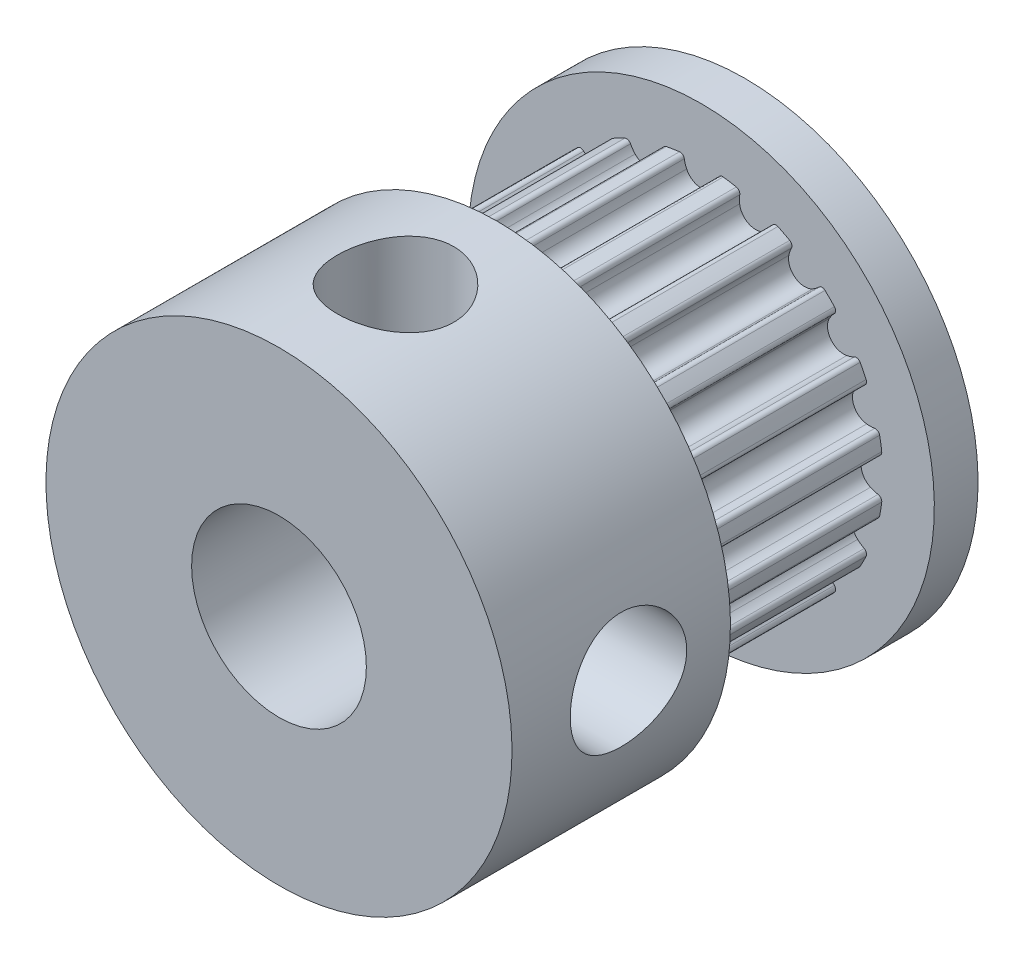
from build123d import *

# Parameters (mm, degrees)
CROQUIS1_R              = 6.366
SALIENTE_EXTRUIR1_DEPTH = 7
CORTAR_EXTRUIR1_DEPTH   = 12.404030516
MATRIZC1_COUNT          = 20
CROQUIS5_W              = 1.5
CROQUIS5_H              = 8
CROQUIS5_W_2            = 7.5
CROQUIS6_R              = 3
CORTAR_EXTRUIR2_DEPTH   = 20.595917942
CROQUIS8_R              = 2
CORTAR_EXTRUIR3_DEPTH   = 19.391574158
CROQUIS9_R              = 2
CORTAR_EXTRUIR4_DEPTH   = 19.391574324


with BuildPart() as part:
    # Croquis1 → Saliente-Extruir1 (new body)
    with BuildSketch(Plane.XY):
        Circle(CROQUIS1_R)
    extrude(amount=SALIENTE_EXTRUIR1_DEPTH)

    # Croquis3 → Cortar-Extruir1 (cut, through all)
    with BuildSketch(Plane(origin=(0, 0, 0), x_dir=(-1, 0, 0), z_dir=(0, 0, -1))):
        with BuildLine():
            Line((-7.140411071, 45.082781216), (-0.995861804, 6.287623976))
            Line((-0.995861804, 6.287623976), (-0.975994627, 6.162187557))
            ThreePointArc((-0.975994627, 6.162187557), (-0.863064611, 6.179016142), (-0.749845546, 6.193775315))
            ThreePointArc((-0.749845546, 6.193775315), (-0.641504612, 6.164627299), (-0.583688192, 6.068478318))
            ThreePointArc((-0.583688192, 6.068478318), (-0.55273127, 5.93441999), (-0.503666473, 5.805879678))
            ThreePointArc((-0.503666473, 5.805879678), (0, 5.484), (0.503666473, 5.805879678))
            ThreePointArc((0.503666473, 5.805879678), (0.55273127, 5.93441999), (0.583688192, 6.068478318))
            ThreePointArc((0.583688192, 6.068478318), (0.641504612, 6.164627299), (0.749845546, 6.193775315))
            ThreePointArc((0.749845546, 6.193775315), (0.863064611, 6.179016142), (0.975994627, 6.162187557))
            Line((0.975994627, 6.162187557), (0.995861804, 6.287623976))
            Line((0.995861804, 6.287623976), (7.140411071, 45.082781216))
            Line((7.140411071, 45.082781216), (7.140411071, 123.640268725))
            Line((7.140411071, 123.640268725), (-7.140411071, 123.640268725))
            Line((-7.140411071, 123.640268725), (-7.140411071, 45.082781216))
        make_face()
    cortar_extruir1 = extrude(amount=-CORTAR_EXTRUIR1_DEPTH, mode=Mode.SUBTRACT)

    # MatrizC1: Cortar-Extruir1 ×20 about axis
    matrizc1_axis = Axis((0, 0, 0), (0, 0, 1))
    for i in range(1, MATRIZC1_COUNT):
        add(cortar_extruir1.rotate(matrizc1_axis, i * 360 / MATRIZC1_COUNT), mode=Mode.SUBTRACT)

    # Croquis5 → Revolución1 (revolve)
    with BuildSketch(Plane(origin=(0, 0, 0), x_dir=(0, 0, -1), z_dir=(1, 0, 0))):
        with Locations((0.75, 4)):
            Rectangle(CROQUIS5_W, CROQUIS5_H)
        with Locations((-10.75, 4)):
            Rectangle(CROQUIS5_W_2, CROQUIS5_H)
    revolve(axis=Axis((0, 0, 7), (0, 0, 1)))

    # Croquis6 → Cortar-Extruir2 (cut, through all)
    with BuildSketch(Plane.XY.offset(14.5)):
        Circle(CROQUIS6_R)
    extrude(amount=-CORTAR_EXTRUIR2_DEPTH, mode=Mode.SUBTRACT)

    # Croquis8 → Cortar-Extruir3 (cut, through all)
    with BuildSketch(Plane(origin=(0, 0, 0), x_dir=(1, 0, 0), z_dir=(0, 1, 0))):
        with Locations(Location((0, -10.5, 0), (0, 0, 90))):
            Circle(CROQUIS8_R)
    extrude(amount=CORTAR_EXTRUIR3_DEPTH, mode=Mode.SUBTRACT)

    # Croquis9 → Cortar-Extruir4 (cut, through all)
    with BuildSketch(Plane(origin=(0, 0, 0), x_dir=(0, 0, -1), z_dir=(1, 0, 0))):
        with Locations(Location((-10.5, 0, 0), (0, 0, 180))):
            Circle(CROQUIS9_R)
    extrude(amount=CORTAR_EXTRUIR4_DEPTH, mode=Mode.SUBTRACT)


solid = part.part
